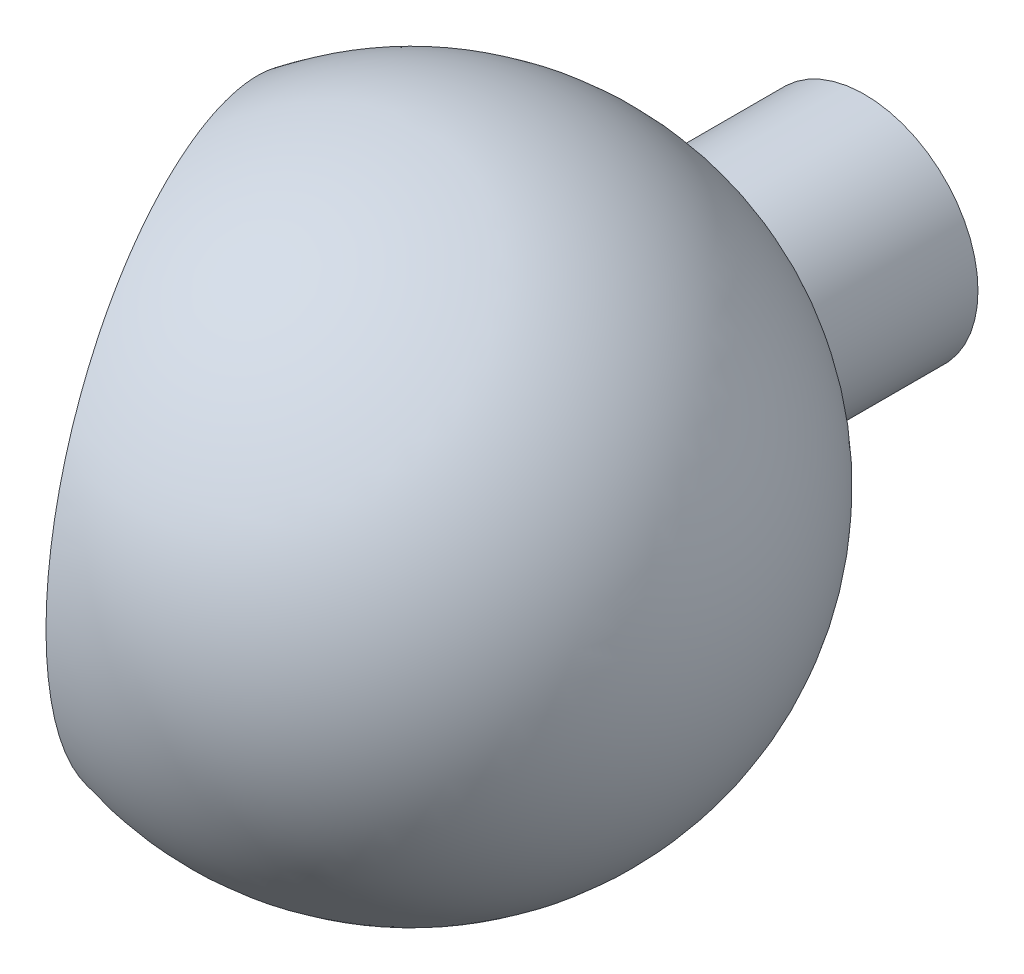
from build123d import *
from build123d.topology import SkipClean

# Parameters (mm, degrees)
ESQUISSE1_R                  = 2
BOSS_EXTRU_1_DEPTH           = 5
ENL_V_MAT_EXTRU_1_DEPTH      = 10
ENL_V_MAT_EXTRU_1_DEPTH_BACK = 10


with BuildPart() as part:
    # Esquisse1 → Boss.-Extru.1 (new body)
    with BuildSketch(Plane.XY):
        Circle(ESQUISSE1_R)
    extrude(amount=BOSS_EXTRU_1_DEPTH)

    # Esquisse3 → Révolution1 (revolve)
    with BuildSketch(Plane(origin=(0, 0, 8), x_dir=(-1, 0, 0), z_dir=(0, 0, -1))):
        with BuildLine():
            Line((0, 5.5), (0, -5.5))
            ThreePointArc((0, -5.5), (-5.5, 0), (0, 5.5))
        make_face()
    revolve(axis=Axis((0, 5.5, 8), (0, -1, 0)))

    # Esquisse5 → Enlèv. mat.-Extru.1 (cut, two sides: drawn at the far end of the back side and taken through both)
    with SkipClean():  # the faces are left unmerged after this step: merging them gives an invalid solid
        with BuildSketch(Plane(origin=(0, 0, 0), x_dir=(1, 0, 0), z_dir=(0, 1, 0)).offset(-ENL_V_MAT_EXTRU_1_DEPTH_BACK)):
            Polygon((-3.854922599, -5.678454878), (-1.460781596, -12.256303223), (-1.044546308, -13.399900278), (-8.646932168, -16.16694244), (-11.873543747, -7.301899986), (-4.271157887, -4.534857823), align=None)
        extrude(amount=ENL_V_MAT_EXTRU_1_DEPTH + ENL_V_MAT_EXTRU_1_DEPTH_BACK, mode=Mode.SUBTRACT)

    # Esquisse6 → Enlèvement de matière-Révolution2 (revolve, cut)
    with SkipClean():  # the faces are left unmerged after this step: merging them gives an invalid solid
        with BuildSketch(Plane(origin=(0, 0, 8), x_dir=(-1, 0, 0), z_dir=(0, 0, -1))):
            with BuildLine():
                Line((-4.5, 0), (4.5, 0))
                ThreePointArc((4.5, 0), (0, 4.5), (-4.5, 0))
            make_face()
        revolve(axis=Axis((4.5, 0, 8), (-1, 0, 0)), mode=Mode.SUBTRACT)


solid = part.part
